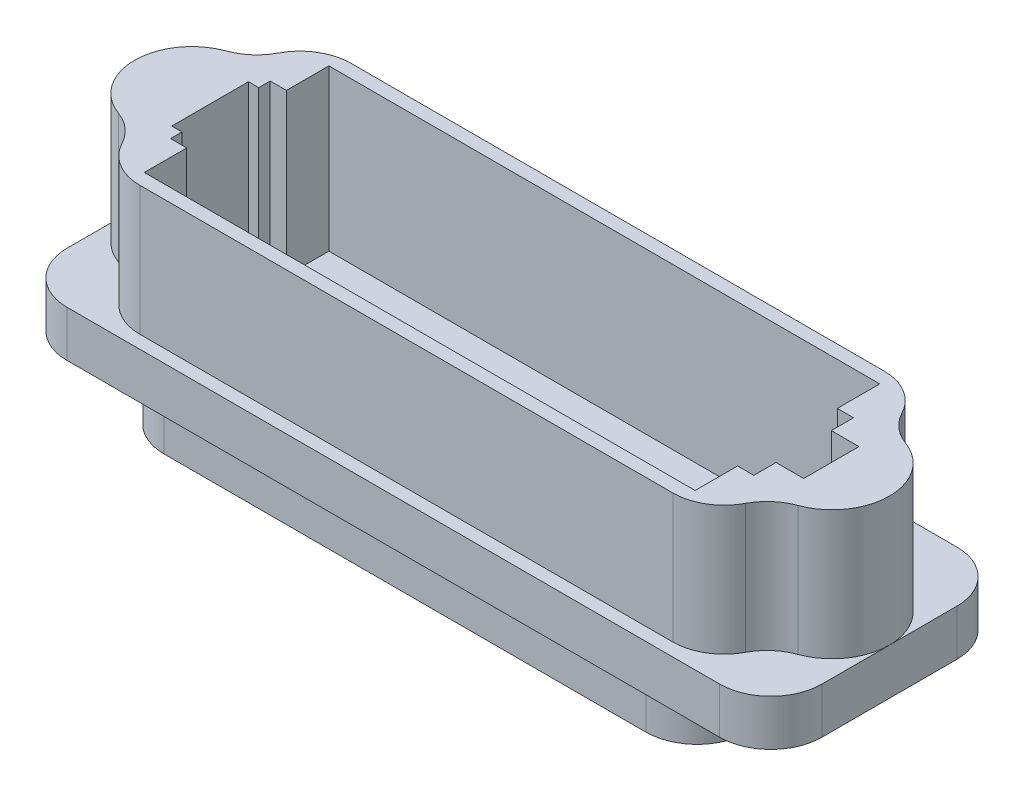
from build123d import *

# Parameters (mm, degrees)
EXTRUDE_1_DEPTH          = 2.25
EXTRUDE_2_DEPTH          = 12.61
FILLET_1_R               = 5
EXTRUDE_3_DEPTH          = 4.3
CUT_EXTRUDE_1_DEPTH      = 45.196553708
CUT_EXTRUDE_1_DEPTH_BACK = 15.68
SKETCH_4_W               = 53.83
SKETCH_4_H               = 4.15
SKETCH_4_W_2             = 1
SKETCH_4_H_2             = 7.5
SKETCH_4_W_3             = 1.585
SKETCH_4_H_3             = 5.4
SKETCH_4_W_4             = 2.705
SKETCH_4_W_5             = 1.12
SKETCH_4_H_4             = 2.17


with BuildPart() as part:
    # Эскиз1 → Бобышка-Вытянуть1 (new, symmetric)
    with BuildSketch(Plane(origin=(0, 0, 0), x_dir=(1, 0, 0), z_dir=(0, 1, 0))):
        with BuildLine():
            Line((-31.885, 11.595), (31.885, 11.595))
            ThreePointArc((31.885, 11.595), (35.420533906, 10.130533906), (36.885, 6.595))
            Line((36.885, 6.595), (36.885, -6.595))
            ThreePointArc((36.885, -6.595), (35.420533906, -10.130533906), (31.885, -11.595))
            Line((31.885, -11.595), (-31.885, -11.595))
            ThreePointArc((-31.885, -11.595), (-35.420533906, -10.130533906), (-36.885, -6.595))
            Line((-36.885, -6.595), (-36.885, 6.595))
            ThreePointArc((-36.885, 6.595), (-35.420533906, 10.130533906), (-31.885, 11.595))
        make_face()
    extrude(amount=EXTRUDE_1_DEPTH, both=True)

    # Эскиз2 → Бобышка-Вытянуть2 (add)
    with BuildSketch(Plane(origin=(0, 2.25, 0), x_dir=(1, 0, 0), z_dir=(0, 1, 0))):
        with BuildLine():
            ThreePointArc((-31.04, 5.32), (-31.038038076, 5.460054955), (-31.032153844, 5.6))
            Line((-31.032153844, 5.6), (-31.285, 5.6))
            ThreePointArc((-31.285, 5.6), (-36.885, 0), (-31.285, -5.6))
            Line((-31.285, -5.6), (-31.032153844, -5.6))
            ThreePointArc((-31.032153844, -5.6), (-31.038038076, -5.460054955), (-31.04, -5.32))
            Line((-31.04, -5.32), (-31.04, 5.32))
        make_face()
        with BuildLine():
            Line((31.032153844, -5.6), (-31.032153844, -5.6))
            ThreePointArc((-31.032153844, -5.6), (-29.475112807, -8.953180425), (-26.04, -10.32))
            Line((-26.04, -10.32), (26.04, -10.32))
            ThreePointArc((26.04, -10.32), (29.475112807, -8.953180425), (31.032153844, -5.6))
        make_face()
        with BuildLine():
            Line((31.032153844, 5.6), (-31.032153844, 5.6))
            ThreePointArc((-31.032153844, 5.6), (-31.038038076, 5.460054955), (-31.04, 5.32))
            Line((-31.04, 5.32), (-31.04, -5.32))
            ThreePointArc((-31.04, -5.32), (-31.038038076, -5.460054955), (-31.032153844, -5.6))
            Line((-31.032153844, -5.6), (31.032153844, -5.6))
            ThreePointArc((31.032153844, -5.6), (31.038038076, -5.460054955), (31.04, -5.32))
            Line((31.04, -5.32), (31.04, 5.32))
            ThreePointArc((31.04, 5.32), (31.038038076, 5.460054955), (31.032153844, 5.6))
        make_face()
        with BuildLine():
            Line((26.04, 10.32), (-26.04, 10.32))
            ThreePointArc((-26.04, 10.32), (-29.475112807, 8.953180425), (-31.032153844, 5.6))
            Line((-31.032153844, 5.6), (31.032153844, 5.6))
            ThreePointArc((31.032153844, 5.6), (29.475112807, 8.953180425), (26.04, 10.32))
        make_face()
        with BuildLine():
            Line((31.285, 5.6), (31.032153844, 5.6))
            ThreePointArc((31.032153844, 5.6), (31.038038076, 5.460054955), (31.04, 5.32))
            Line((31.04, 5.32), (31.04, -5.32))
            ThreePointArc((31.04, -5.32), (31.038038076, -5.460054955), (31.032153844, -5.6))
            Line((31.032153844, -5.6), (31.285, -5.6))
            ThreePointArc((31.285, -5.6), (36.885, 0), (31.285, 5.6))
        make_face()
    extrude(amount=EXTRUDE_2_DEPTH)

    # Скругление1
    fillet_1_edges = [part.edges().sort_by_distance(p)[0] for p in [
        (-31.032153844, 8.555, 5.6),
        (-31.032153844, 8.555, -5.6),
        (31.032153844, 8.555, -5.6),
        (31.032153844, 8.555, 5.6),
    ]]
    fillet(fillet_1_edges, radius=FILLET_1_R)

    # Эскиз3 → Бобышка-Вытянуть3 (add)
    with BuildSketch(Plane.XZ.offset(2.25)):
        with BuildLine():
            Line((-23.555, 10.465), (23.555, 10.465))
            ThreePointArc((23.555, 10.465), (27.090533906, 9.000533906), (28.555, 5.465))
            Line((28.555, 5.465), (28.555, -5.465))
            ThreePointArc((28.555, -5.465), (27.090533906, -9.000533906), (23.555, -10.465))
            Line((23.555, -10.465), (-23.555, -10.465))
            ThreePointArc((-23.555, -10.465), (-27.090533906, -9.000533906), (-28.555, -5.465))
            Line((-28.555, -5.465), (-28.555, 5.465))
            ThreePointArc((-28.555, 5.465), (-27.090533906, 9.000533906), (-23.555, 10.465))
        make_face()
    extrude(amount=EXTRUDE_3_DEPTH)

    # Эскиз4 → Вырез-Вытянуть1 (cut, two sides: drawn at the far end of the back side and taken through both)
    with BuildSketch(Plane(origin=(0, 14.86, 0), x_dir=(1, 0, 0), z_dir=(0, 1, 0)).offset(-CUT_EXTRUDE_1_DEPTH_BACK)):
        Polygon((26.915, 4.87), (-26.915, 4.87), (-26.915, -4.87), (26.915, -4.87), (26.915, -2.7), (25.795, -2.7), (25.795, 2.7), (26.915, 2.7), align=None)
        with Locations((0, 6.945)):
            Rectangle(SKETCH_4_W, SKETCH_4_H)
        with Locations((-29, 0)):
            Rectangle(SKETCH_4_W_2, SKETCH_4_H_2)
        with Locations((-28, 0)):
            Rectangle(SKETCH_4_W_2, SKETCH_4_H_2)
        Polygon((-26.915, -4.87), (-26.915, 4.87), (-28.5, 4.87), (-28.5, 3.75), (-27.5, 3.75), (-27.5, -3.75), (-28.5, -3.75), (-28.5, -4.87), align=None)
        with Locations((0, -6.945)):
            Rectangle(SKETCH_4_W, SKETCH_4_H)
        with Locations((27.7075, 0)):
            Rectangle(SKETCH_4_W_3, SKETCH_4_H_3)
        with Locations((29.8525, 0)):
            Rectangle(SKETCH_4_W_4, SKETCH_4_H_3)
        with Locations((26.355, 0)):
            Rectangle(SKETCH_4_W_5, SKETCH_4_H_3)
        with Locations((27.7075, -3.785)):
            Rectangle(SKETCH_4_W_3, SKETCH_4_H_4)
        with Locations((27.7075, 3.785)):
            Rectangle(SKETCH_4_W_3, SKETCH_4_H_4)
    extrude(amount=CUT_EXTRUDE_1_DEPTH + CUT_EXTRUDE_1_DEPTH_BACK, mode=Mode.SUBTRACT)


solid = part.part
